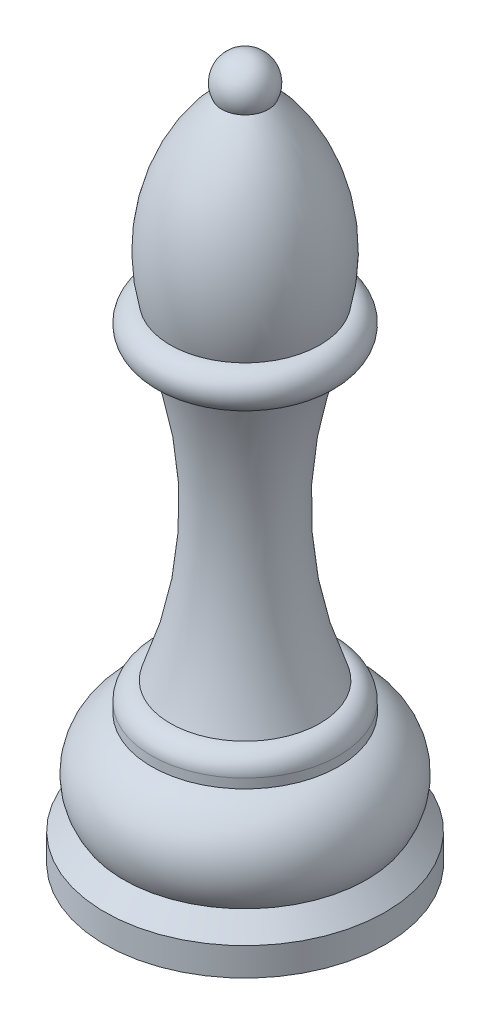
from build123d import *


with BuildPart() as part:
    # Sketch1 → Revolve1 (revolve)
    with BuildSketch(Plane.XY, mode=Mode.PRIVATE) as revolve1_sk:
        with BuildLine():
            Line((-15, 0), (0, 0))
            Line((0, 0), (0, 71.05))
            Line((0, 71.05), (-2.5, 71.05))
            ThreePointArc((-2.5, 71.05), (-7.779672348, 62.249968411), (-8, 51.99))
            ThreePointArc((-8, 51.99), (-9.414213562, 51.404213562), (-10, 49.99))
            ThreePointArc((-10, 49.99), (-9.414213562, 48.575786438), (-8, 47.99))
            Line((-8, 47.99), (-7.5, 47.99))
            ThreePointArc((-7.5, 47.99), (-4.992249752, 32.435548835), (-8, 16.97))
            ThreePointArc((-8, 16.97), (-9.414213562, 16.384213562), (-10, 14.97))
            Line((-10, 14.97), (-10, 13.97))
            ThreePointArc((-10, 13.97), (-13.688325627, 10.216881481), (-13, 5))
            Line((-13, 5), (-15, 3))
            Line((-15, 3), (-15, 0))
        make_face()
        with BuildLine():
            Line((-2.5, 71.05), (0, 71.05))
            Line((0, 71.05), (0, 75.05))
            ThreePointArc((0, 75.05), (-2.358495283, 73.742809552), (-2.5, 71.05))
        make_face()
    revolve(revolve1_sk.sketch.rotate(Axis((0, -540.323818274, 0), (0, 1, 0)), 180), axis=Axis((0, -540.323818274, 0), (0, 1, 0)))


solid = part.part
